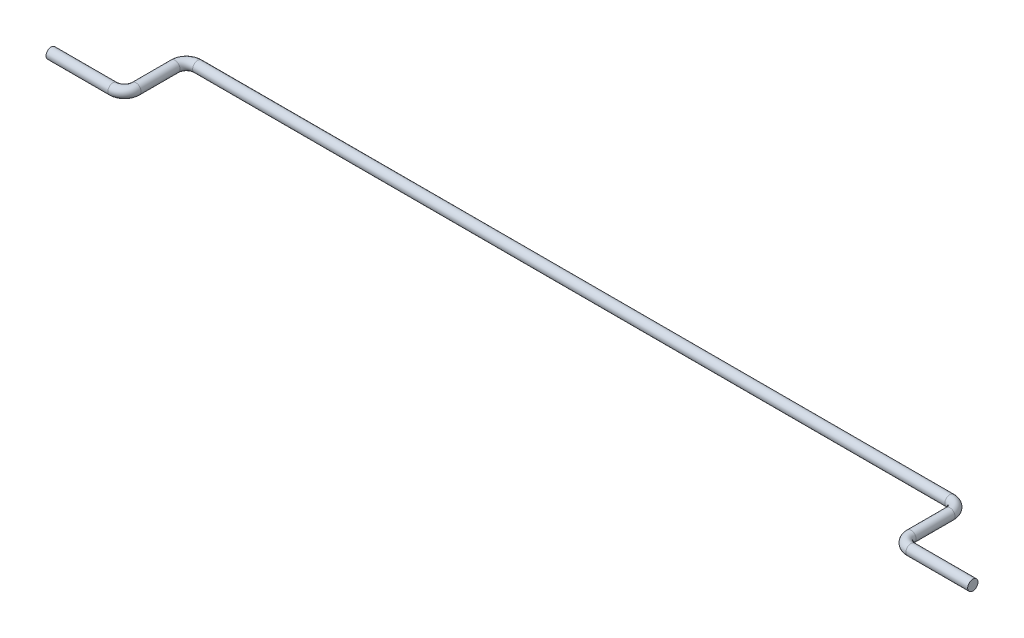
from build123d import *

# Parameters (mm, degrees)
SKETCH2_R = 0.5715


with BuildPart() as part:
    # Sweep1: sweep along a path in Sketch1
    with BuildLine(Plane(origin=(0, 0, 0), x_dir=(1, 0, 0), z_dir=(0, 1, 0))) as sweep1_path:
        Line((0, 0), (6.858, 0))
        ThreePointArc((6.858, 0), (7.756025612, 0.371974388), (8.128, 1.27))
        Line((8.128, 1.27), (8.128, 5.588))
        ThreePointArc((8.128, 5.588), (8.499974388, 6.486025612), (9.398, 6.858))
        Line((9.398, 6.858), (92.7862, 6.858))
        ThreePointArc((92.7862, 6.858), (93.684225612, 6.486025612), (94.0562, 5.588))
        Line((94.0562, 5.588), (94.0562, 1.27))
        ThreePointArc((94.0562, 1.27), (94.428174388, 0.371974388), (95.3262, 0))
        Line((95.3262, 0), (102.1842, 0))
    # Sketch2 → Sweep1 (sweep)
    with BuildSketch(Plane(origin=(0, 0, 0), x_dir=(0, 0, -1), z_dir=(1, 0, 0))):
        Circle(SKETCH2_R)
    sweep(path=sweep1_path.line)


solid = part.part
